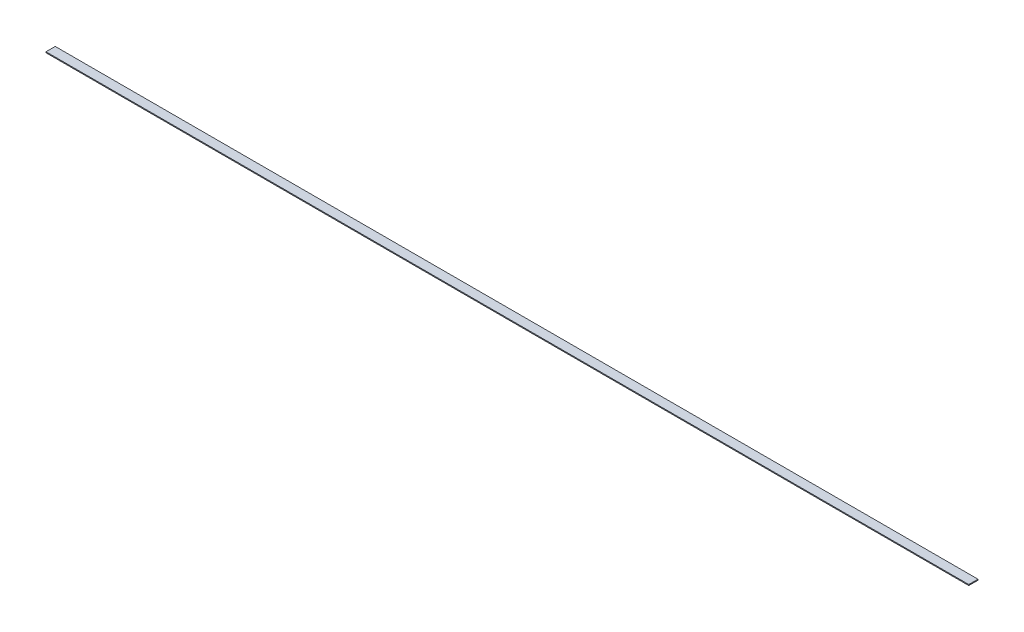
from build123d import *

# Parameters (mm, degrees)
SKETCH1_W           = 1000
SKETCH1_H           = 1
BOSS_EXTRUDE1_DEPTH = 10


with BuildPart() as part:
    # Sketch1 → Boss-Extrude1 (new body)
    with BuildSketch(Plane.XY):
        with Locations((500, 0.5)):
            Rectangle(SKETCH1_W, SKETCH1_H)
    extrude(amount=BOSS_EXTRUDE1_DEPTH)


solid = part.part
